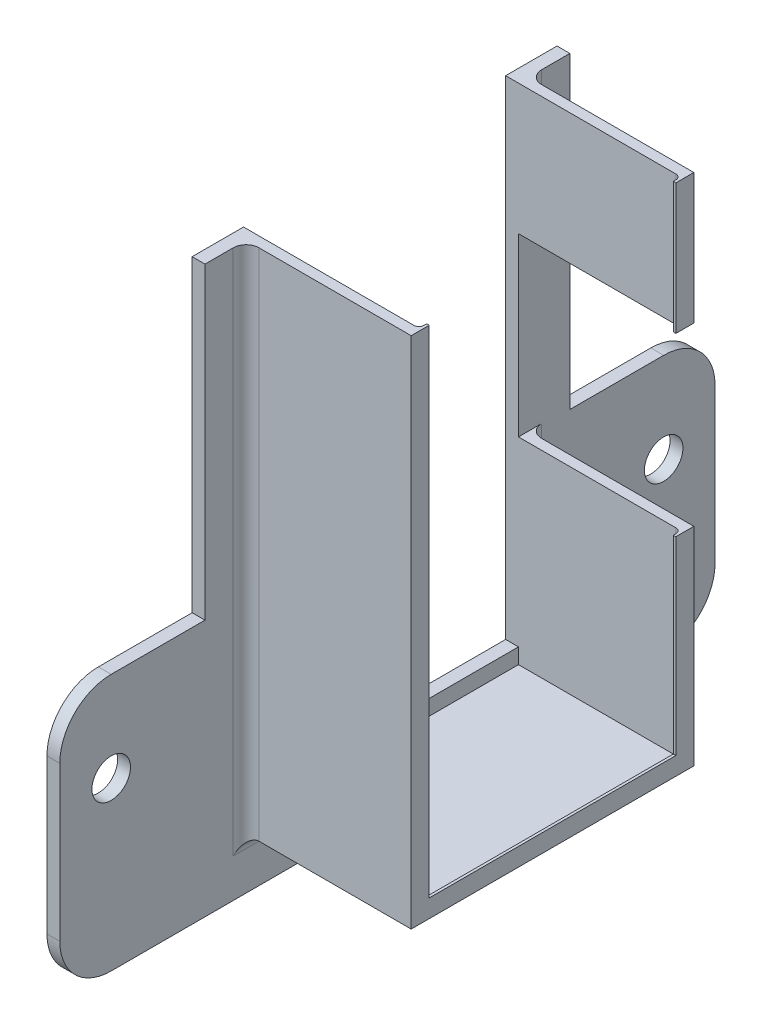
from build123d import *

# Parameters (mm, degrees)
BOSS_EXTRUDE1_DEPTH   = 1
FILLET2_R             = 4
SKETCH2_W             = 20.4
SKETCH2_H             = 0.8
BOSS_EXTRUDE2_DEPTH   = 12.25
SKETCH3_W             = 0.8
SKETCH3_H             = 40
BOSS_EXTRUDE3_DEPTH   = 12.25
SKETCH5_W             = 0.8
SKETCH5_H             = 16.15
SKETCH5_H_2           = 10.15
BOSS_EXTRUDE4_DEPTH   = 12.25
FILLET3_R             = 1
SKETCH6_W             = 0.8
SKETCH6_H             = 10.15
BOSS_EXTRUDE5_DEPTH   = 0.6
SKETCH7_W             = 0.6
SKETCH7_H             = 10.15
EXTRUDE_THIN1_DEPTH   = 0.2
FILLET4_R             = 0.4
F_3_0MM_DOWEL_HOLE2_D = 3


with BuildPart() as part:
    # Sketch1 → Boss-Extrude1 (new body)
    with BuildSketch(Plane(origin=(-75.536427928, 0, 0), x_dir=(0, 0, -1), z_dir=(1, 0, 0))):
        Polygon((-25.5, 40.4), (-25.5, 54.4), (-14.2, 54.4), (-14.2, 78.4), (-10.2, 78.4), (-10.2, 54.4), (-10.2, 40.4), (10.2, 40.4), (10.2, 54.4), (10.2, 78.4), (14.2, 78.4), (14.2, 54.4), (25.5, 54.4), (25.5, 40.4), (25.5, 34.4), (-25.5, 34.4), align=None)
    extrude(amount=BOSS_EXTRUDE1_DEPTH)

    # Fillet2
    fillet2_edges = [part.edges().sort_by_distance(p)[0] for p in [
        (-75.036427928, 54.4, -25.5),
        (-75.036427928, 34.4, -25.5),
        (-75.036427928, 34.4, 25.5),
        (-75.036427928, 54.4, 25.5),
    ]]
    fillet(fillet2_edges, radius=FILLET2_R)

    # Sketch2 → Boss-Extrude2 (add)
    with BuildSketch(Plane(origin=(-74.536427928, 0, 0), x_dir=(0, 0, -1), z_dir=(1, 0, 0))):
        with Locations((0, 38.8)):
            Rectangle(SKETCH2_W, SKETCH2_H)
    extrude(amount=BOSS_EXTRUDE2_DEPTH)

    # Sketch3 → Boss-Extrude3 (add)
    with BuildSketch(Plane(origin=(-74.536427928, 0, 0), x_dir=(0, 0, -1), z_dir=(1, 0, 0))):
        with Locations((-10.6, 58.4)):
            Rectangle(SKETCH3_W, SKETCH3_H)
    extrude(amount=BOSS_EXTRUDE3_DEPTH)

    # Sketch5 → Boss-Extrude4 (add)
    with BuildSketch(Plane(origin=(-74.536427928, 0, 0), x_dir=(0, 0, -1), z_dir=(1, 0, 0))):
        with Locations((10.6, 46.475)):
            Rectangle(SKETCH5_W, SKETCH5_H)
        with Locations((10.6, 73.325)):
            Rectangle(SKETCH5_W, SKETCH5_H_2)
    extrude(amount=BOSS_EXTRUDE4_DEPTH)

    # Fillet3
    fillet3_edges = [part.edges().sort_by_distance(p)[0] for p in [
        (-74.536427928, 46.475, -11),
        (-74.536427928, 73.325, -11),
        (-74.536427928, 38.4, 0),
        (-74.536427928, 58.4, 11),
    ]]
    fillet(fillet3_edges, radius=FILLET3_R)

    # Sketch6 → Boss-Extrude5 (add)
    with BuildSketch(Plane(origin=(-62.286427928, 0, 0), x_dir=(0, 0, -1), z_dir=(1, 0, 0))):
        Polygon((-11, 38.4), (11, 38.4), (11, 54.55), (10.2, 54.55), (10.2, 39.2), (-10.2, 39.2), (-10.2, 78.4), (-11, 78.4), align=None)
        with Locations((10.6, 73.325)):
            Rectangle(SKETCH6_W, SKETCH6_H)
    extrude(amount=BOSS_EXTRUDE5_DEPTH)

    # Sketch7 → Extrude-Thin1 (add)
    with BuildSketch(Plane(origin=(-61.686427928, 0, 0), x_dir=(0, 0, -1), z_dir=(1, 0, 0))):
        with Locations((9.9, 73.325)):
            Rectangle(SKETCH7_W, SKETCH7_H)
        Polygon((10.2, 54.55), (10.2, 39.2), (-10.2, 39.2), (-10.2, 78.4), (-9.6, 78.4), (-9.6, 39.8), (9.6, 39.8), (9.6, 54.55), align=None)
    extrude(amount=-EXTRUDE_THIN1_DEPTH)

    # Fillet4
    fillet4_edges = [part.edges().sort_by_distance(p)[0] for p in [
        (-61.886427928, 73.325, -10.2),
        (-61.886427928, 46.875, -10.2),
        (-61.886427928, 39.2, 0),
        (-61.886427928, 58.8, 10.2),
    ]]
    fillet(fillet4_edges, radius=FILLET4_R)

    # Ø3.0mm Dowel Hole2 (through all)
    with Locations(Plane(origin=(-74.536427928, 0, 0), x_dir=(0, 0, -1), z_dir=(1, 0, 0))):
        with Locations((21.5, 47.4), (-21.5, 47.4)):
            Hole(F_3_0MM_DOWEL_HOLE2_D / 2)


solid = part.part
